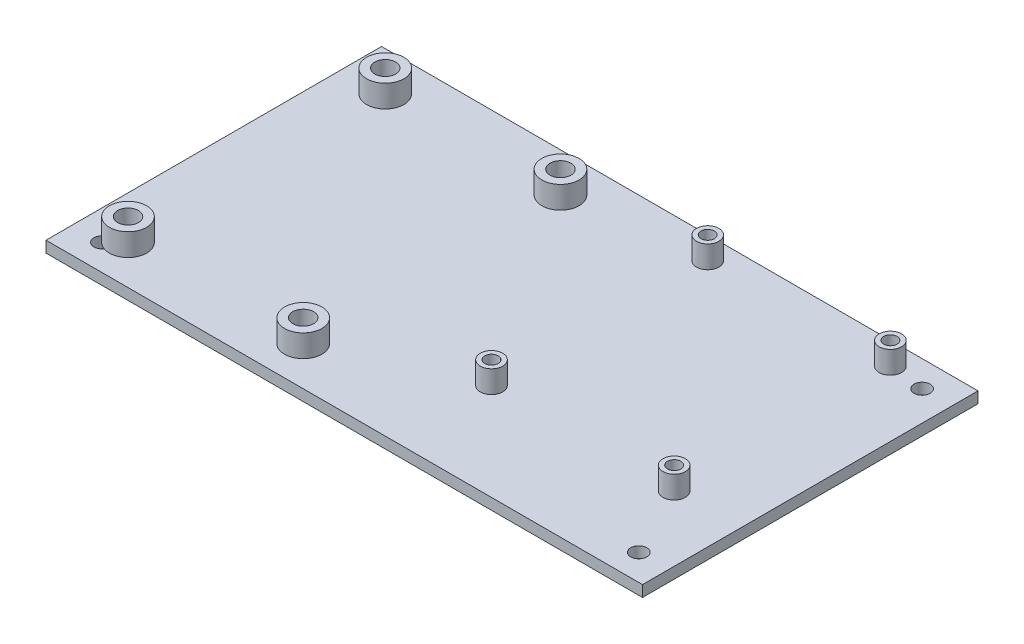
from build123d import *

# Parameters (mm, degrees)
SK_PLATE_W         = 160
SK_PLATE_H         = 90
EX_PLATE_DEPTH     = 3
SK_STANDOFFS_R     = 3
SK_STANDOFFS_R_2   = 5
EX_STANDOFFS_DEPTH = 6
SK_INSERTS_R       = 1.8
SK_INSERTS_R_2     = 2.8
CUT_INSERTS_DEPTH  = 6
SK_PANHOLES_R      = 2.15
CUT_PANHOLES_DEPTH = 3


with BuildPart() as part:
    # SK_Plate → EX_Plate (new body)
    with BuildSketch(Plane(origin=(0, 0, 0), x_dir=(1, 0, 0), z_dir=(0, 1, 0))):
        Rectangle(SK_PLATE_W, SK_PLATE_H)
    extrude(amount=EX_PLATE_DEPTH)

    # SK_Standoffs → EX_Standoffs (add)
    with BuildSketch(Plane(origin=(0, 3, 0), x_dir=(1, 0, 0), z_dir=(0, 1, 0))):
        with Locations((62.5, 39)):
            Circle(SK_STANDOFFS_R)
        with Locations((13.5, 39)):
            Circle(SK_STANDOFFS_R)
        with Locations((62.5, -19)):
            Circle(SK_STANDOFFS_R)
        with Locations((13.5, -19)):
            Circle(SK_STANDOFFS_R)
        with Locations((-21.5, -34.5)):
            Circle(SK_STANDOFFS_R_2)
        with Locations((-68.5, -34.5)):
            Circle(SK_STANDOFFS_R_2)
        with Locations((-21.5, 34.5)):
            Circle(SK_STANDOFFS_R_2)
        with Locations((-68.5, 34.5)):
            Circle(SK_STANDOFFS_R_2)
    extrude(amount=EX_STANDOFFS_DEPTH)

    # SK_Inserts → CUT_Inserts (cut)
    with BuildSketch(Plane(origin=(0, 9, 0), x_dir=(1, 0, 0), z_dir=(0, 1, 0))):
        with Locations((62.5, 39)):
            Circle(SK_INSERTS_R)
        with Locations((13.5, 39)):
            Circle(SK_INSERTS_R)
        with Locations((62.5, -19)):
            Circle(SK_INSERTS_R)
        with Locations((13.5, -19)):
            Circle(SK_INSERTS_R)
        with Locations((-21.5, -34.5)):
            Circle(SK_INSERTS_R_2)
        with Locations((-68.5, -34.5)):
            Circle(SK_INSERTS_R_2)
        with Locations((-21.5, 34.5)):
            Circle(SK_INSERTS_R_2)
        with Locations((-68.5, 34.5)):
            Circle(SK_INSERTS_R_2)
    extrude(amount=-CUT_INSERTS_DEPTH, mode=Mode.SUBTRACT)

    # SK_PanHoles → CUT_PanHoles (cut)
    with BuildSketch(Plane(origin=(0, 0, 0), x_dir=(1, 0, 0), z_dir=(0, 1, 0))):
        with Locations((72, -38)):
            Circle(SK_PANHOLES_R)
        with Locations((-72, -38)):
            Circle(SK_PANHOLES_R)
        with Locations((72, 38)):
            Circle(SK_PANHOLES_R)
        with Locations((-72, 38)):
            Circle(SK_PANHOLES_R)
    extrude(amount=CUT_PANHOLES_DEPTH, mode=Mode.SUBTRACT)


solid = part.part
